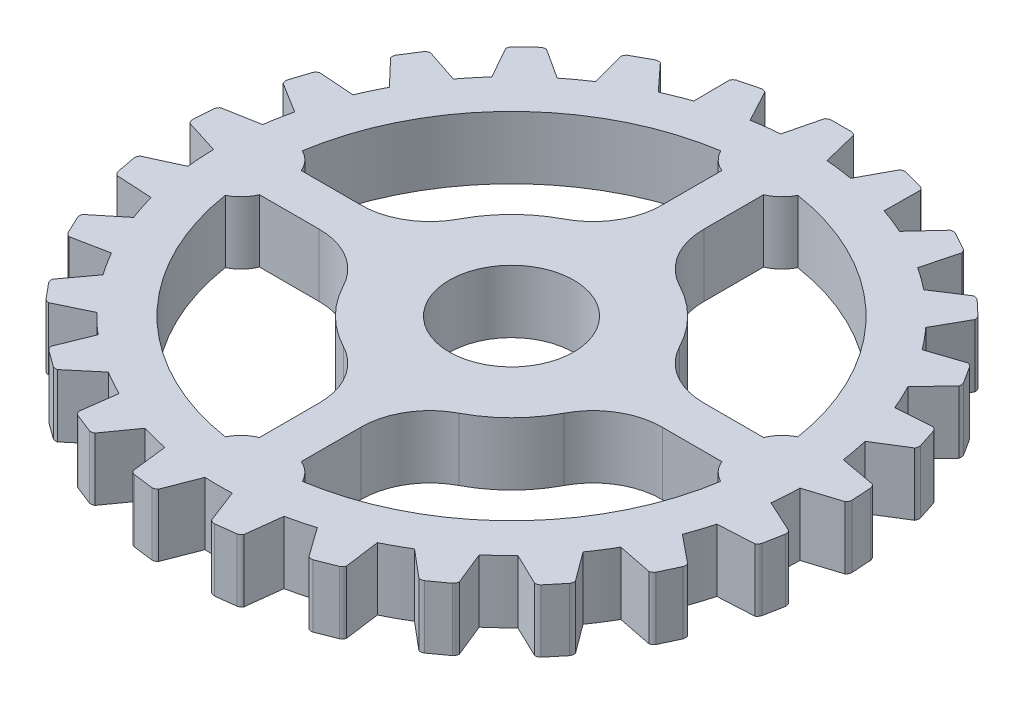
from build123d import *

# Parameters (mm, degrees)
SZKIC1_R                    = 29.81004902
DODANIE_WYCI_GNI_CIE2_DEPTH = 30


with BuildPart() as part:
    # Szkic1 → Dodanie-wyciągnięcie2 (new body)
    with BuildSketch(Plane(origin=(0, 0, 0), x_dir=(1, 0, 0), z_dir=(0, 1, 0))):
        with BuildLine():
            ThreePointArc((6.930347627, 127.950685559), (0.900324506, 130.502399747), (-5.242141735, 132.770115034))
            Line((-5.242141735, 132.770115034), (-5.099538392, 150.025168008))
            ThreePointArc((-5.099538392, 150.025168008), (-5.818909002, 150.99433569), (-6.838983407, 151.639493252))
            Line((-6.838983407, 151.639493252), (-16.212716976, 154.046258966))
            ThreePointArc((-16.212716976, 154.046258966), (-17.417422017, 153.972327677), (-18.514711379, 153.469598998))
            Line((-18.514711379, 153.469598998), (-26.702432285, 138.280181128))
            ThreePointArc((-26.702432285, 138.280181128), (-33.177596654, 139.252122754), (-39.691043882, 139.921024358))
            Line((-39.691043882, 139.921024358), (-43.844077863, 156.669442122))
            ThreePointArc((-43.844077863, 156.669442122), (-44.781870324, 157.429261423), (-45.930341376, 157.800467985))
            Line((-45.930341376, 157.800467985), (-55.608120162, 157.800467985))
            ThreePointArc((-55.608120162, 157.800467985), (-56.756591215, 157.429261423), (-57.694383676, 156.669442122))
            Line((-57.694383676, 156.669442122), (-61.847417657, 139.921024358))
            ThreePointArc((-61.847417657, 139.921024358), (-68.360864884, 139.252122754), (-74.836029254, 138.280181128))
            Line((-74.836029254, 138.280181128), (-83.023750159, 153.469598998))
            ThreePointArc((-83.023750159, 153.469598998), (-84.121039522, 153.972327677), (-85.325744562, 154.046258966))
            Line((-85.325744562, 154.046258966), (-94.699478132, 151.639493252))
            ThreePointArc((-94.699478132, 151.639493252), (-95.719552536, 150.99433569), (-96.438923146, 150.025168008))
            Line((-96.438923146, 150.025168008), (-96.296319804, 132.770115034))
            ThreePointArc((-96.296319804, 132.770115034), (-102.438786045, 130.502399747), (-108.468809166, 127.950685559))
            Line((-108.468809166, 127.950685559), (-120.176752379, 140.626696547))
            ThreePointArc((-120.176752379, 140.626696547), (-121.364591917, 140.840746312), (-122.549834897, 140.612756953))
            Line((-122.549834897, 140.612756953), (-131.030537095, 135.950451466))
            ThreePointArc((-131.030537095, 135.950451466), (-131.858119825, 135.071880527), (-132.313867883, 133.954260834))
            Line((-132.313867883, 133.954260834), (-127.88458751, 117.276771088))
            ThreePointArc((-127.88458751, 117.276771088), (-133.27011902, 113.552731011), (-138.476112363, 109.581577847))
            Line((-138.476112363, 109.581577847), (-152.968624752, 118.947701563))
            ThreePointArc((-152.968624752, 118.947701563), (-154.172378139, 118.859622881), (-155.263685884, 118.344038284))
            Line((-155.263685884, 118.344038284), (-162.318483002, 111.719142824))
            ThreePointArc((-162.318483002, 111.719142824), (-162.901573991, 110.66236235), (-163.06506317, 109.466514802))
            Line((-163.06506317, 109.466514802), (-154.627413742, 94.414496301))
            ThreePointArc((-154.627413742, 94.414496301), (-158.917617769, 89.468126567), (-162.972469626, 84.327056585))
            Line((-162.972469626, 84.327056585), (-179.338933339, 89.794785031))
            ThreePointArc((-179.338933339, 89.794785031), (-180.482964322, 89.410112208), (-181.411765952, 88.63932845))
            Line((-181.411765952, 88.63932845), (-186.597379141, 80.468109564))
            ThreePointArc((-186.597379141, 80.468109564), (-186.899340638, 79.29952096), (-186.760298312, 78.100585056))
            Line((-186.760298312, 78.100585056), (-174.844448374, 65.619811479))
            ThreePointArc((-174.844448374, 65.619811479), (-177.769755622, 59.761910691), (-180.418684737, 53.773956225))
            Line((-180.418684737, 53.773956225), (-197.630734667, 54.999731913))
            ThreePointArc((-197.630734667, 54.999731913), (-198.643159572, 54.342635359), (-199.351095065, 53.365083617))
            Line((-199.351095065, 53.365083617), (-202.341693178, 44.160969039))
            ThreePointArc((-202.341693178, 44.160969039), (-202.34355183, 42.953999024), (-201.910714541, 41.827308317))
            Line((-201.910714541, 41.827308317), (-187.265380767, 32.701992569))
            ThreePointArc((-187.265380767, 32.701992569), (-188.641983422, 26.300634177), (-189.718547838, 19.842040429))
            Line((-189.718547838, 19.842040429), (-206.694687586, 16.748843364))
            ThreePointArc((-206.694687586, 16.748843364), (-207.511892033, 15.860610871), (-207.954479198, 14.737714317))
            Line((-207.954479198, 14.737714317), (-208.562151956, 5.079032416))
            ThreePointArc((-208.562151956, 5.079032416), (-208.263790979, 3.909519356), (-207.564355484, 2.925867966))
            Line((-207.564355484, 2.925867966), (-191.109758058, -2.270612804))
            ThreePointArc((-191.109758058, -2.270612804), (-190.851159113, -8.81320791), (-190.287714328, -15.336623742))
            Line((-190.287714328, -15.336623742), (-205.9612706, -22.554436611))
            ThreePointArc((-205.9612706, -22.554436611), (-206.531906628, -23.617994128), (-206.681336086, -24.815679775))
            Line((-206.681336086, -24.815679775), (-204.867901175, -34.322038492))
            ThreePointArc((-204.867901175, -34.322038492), (-204.288067686, -35.380609791), (-203.365982089, -36.15941543))
            Line((-203.365982089, -36.15941543), (-186.136023883, -37.100547223))
            ThreePointArc((-186.136023883, -37.100547223), (-184.258472061, -43.373283731), (-182.090421382, -49.551631438))
            Line((-182.090421382, -49.551631438), (-195.476566995, -60.440538384))
            ThreePointArc((-195.476566995, -60.440538384), (-195.764779443, -61.612593696), (-195.611661992, -62.809813441))
            Line((-195.611661992, -62.809813441), (-191.491064196, -71.566529494))
            ThreePointArc((-191.491064196, -71.566529494), (-190.666191266, -72.447645104), (-189.579393598, -72.972669769))
            Line((-189.579393598, -72.972669769), (-172.656696253, -69.599317814))
            ThreePointArc((-172.656696253, -69.599317814), (-169.278165039, -75.208056619), (-165.641735065, -80.653127894))
            Line((-165.641735065, -80.653127894), (-175.899369258, -94.528938846))
            ThreePointArc((-175.899369258, -94.528938846), (-175.887048679, -95.735847407), (-175.441005251, -96.85737553))
            Line((-175.441005251, -96.85737553), (-169.272156885, -104.314232245))
            ThreePointArc((-169.272156885, -104.314232245), (-168.254074313, -104.962528432), (-167.070852067, -105.200782892))
            Line((-167.070852067, -105.200782892), (-151.518730895, -97.724907299))
            ThreePointArc((-151.518730895, -97.724907299), (-146.851505832, -102.317230714), (-141.975186831, -106.686891702))
            Line((-141.975186831, -106.686891702), (-148.459784724, -122.677738428))
            ThreePointArc((-148.459784724, -122.677738428), (-148.147705265, -123.843665733), (-147.436762409, -124.819032498))
            Line((-147.436762409, -124.819032498), (-139.607274903, -130.507488143))
            ThreePointArc((-139.607274903, -130.507488143), (-138.459952561, -130.882230073), (-137.254651943, -130.818743924))
            Line((-137.254651943, -130.818743924), (-124.050303914, -119.710081451))
            ThreePointArc((-124.050303914, -119.710081451), (-118.387643917, -122.997436907), (-112.577832946, -126.017125737))
            Line((-112.577832946, -126.017125737), (-114.881943404, -143.118244526))
            ThreePointArc((-114.881943404, -143.118244526), (-114.289714165, -144.169931076), (-113.358543035, -144.937850602))
            Line((-113.358543035, -144.937850602), (-104.360371884, -148.500478588))
            ThreePointArc((-104.360371884, -148.500478588), (-103.155900255, -148.578119848), (-102.004254736, -148.216882158))
            Line((-102.004254736, -148.216882158), (-91.977357598, -134.173430922))
            ThreePointArc((-91.977357598, -134.173430922), (-85.67506842, -135.949261786), (-79.296817271, -137.429240304))
            Line((-79.296817271, -137.429240304), (-77.275664559, -154.566104969))
            ThreePointArc((-77.275664559, -154.566104969), (-76.440497481, -155.43746943), (-75.347606985, -155.949690508))
            Line((-75.347606985, -155.949690508), (-65.746140375, -157.162637817))
            ThreePointArc((-65.746140375, -157.162637817), (-64.560200841, -156.93829992), (-63.534572544, -156.302008583))
            Line((-63.534572544, -156.302008583), (-57.315153121, -140.206170274))
            ThreePointArc((-57.315153121, -140.206170274), (-50.769230769, -140.35889456), (-44.223308418, -140.206170274))
            Line((-44.223308418, -140.206170274), (-38.003888995, -156.302008583))
            ThreePointArc((-38.003888995, -156.302008583), (-36.978260698, -156.93829992), (-35.792321164, -157.162637817))
            Line((-35.792321164, -157.162637817), (-26.190854554, -155.949690508))
            ThreePointArc((-26.190854554, -155.949690508), (-25.097964057, -155.43746943), (-24.26279698, -154.566104969))
            Line((-24.26279698, -154.566104969), (-22.241644268, -137.429240304))
            ThreePointArc((-22.241644268, -137.429240304), (-15.863393118, -135.949261786), (-9.56110394, -134.173430922))
            Line((-9.56110394, -134.173430922), (0.465793198, -148.216882158))
            ThreePointArc((0.465793198, -148.216882158), (1.617438717, -148.578119848), (2.821910346, -148.500478588))
            Line((2.821910346, -148.500478588), (11.820081497, -144.937850602))
            ThreePointArc((11.820081497, -144.937850602), (12.751252626, -144.169931076), (13.343481865, -143.118244526))
            Line((13.343481865, -143.118244526), (11.039371408, -126.017125737))
            ThreePointArc((11.039371408, -126.017125737), (16.849182378, -122.997436907), (22.511842376, -119.710081451))
            Line((22.511842376, -119.710081451), (35.716190405, -130.818743924))
            ThreePointArc((35.716190405, -130.818743924), (36.921491023, -130.882230073), (38.068813364, -130.507488143))
            Line((38.068813364, -130.507488143), (45.89830087, -124.819032498))
            ThreePointArc((45.89830087, -124.819032498), (46.609243726, -123.843665733), (46.921323185, -122.677738428))
            Line((46.921323185, -122.677738428), (40.436725293, -106.686891702))
            ThreePointArc((40.436725293, -106.686891702), (45.313044293, -102.317230714), (49.980269357, -97.724907299))
            Line((49.980269357, -97.724907299), (65.532390529, -105.200782892))
            ThreePointArc((65.532390529, -105.200782892), (66.715612774, -104.962528432), (67.733695347, -104.314232245))
            Line((67.733695347, -104.314232245), (73.902543713, -96.85737553))
            ThreePointArc((73.902543713, -96.85737553), (74.348587141, -95.735847407), (74.36090772, -94.528938846))
            Line((74.36090772, -94.528938846), (64.103273527, -80.653127894))
            ThreePointArc((64.103273527, -80.653127894), (67.739703501, -75.208056619), (71.118234714, -69.599317814))
            Line((71.118234714, -69.599317814), (88.040932059, -72.972669769))
            ThreePointArc((88.040932059, -72.972669769), (89.127729727, -72.447645104), (89.952602658, -71.566529494))
            Line((89.952602658, -71.566529494), (94.073200454, -62.809813441))
            ThreePointArc((94.073200454, -62.809813441), (94.226317905, -61.612593696), (93.938105456, -60.440538384))
            Line((93.938105456, -60.440538384), (80.551959844, -49.551631438))
            ThreePointArc((80.551959844, -49.551631438), (82.720010522, -43.373283731), (84.597562345, -37.100547223))
            Line((84.597562345, -37.100547223), (101.827520551, -36.15941543))
            ThreePointArc((101.827520551, -36.15941543), (102.749606147, -35.380609791), (103.329439636, -34.322038492))
            Line((103.329439636, -34.322038492), (105.142874547, -24.815679775))
            ThreePointArc((105.142874547, -24.815679775), (104.993445089, -23.617994129), (104.422809061, -22.554436611))
            Line((104.422809061, -22.554436611), (88.749252789, -15.336623742))
            ThreePointArc((88.749252789, -15.336623742), (89.312697575, -8.81320791), (89.57129652, -2.270612804))
            Line((89.57129652, -2.270612804), (106.025893945, 2.925867966))
            ThreePointArc((106.025893945, 2.925867966), (106.725329441, 3.909519356), (107.023690418, 5.079032416))
            Line((107.023690418, 5.079032416), (106.41601766, 14.737714317))
            ThreePointArc((106.41601766, 14.737714317), (105.973430495, 15.860610871), (105.156226048, 16.748843364))
            Line((105.156226048, 16.748843364), (88.180086299, 19.842040429))
            ThreePointArc((88.180086299, 19.842040429), (87.103521884, 26.300634177), (85.726919229, 32.701992569))
            Line((85.726919229, 32.701992569), (100.372253002, 41.827308317))
            ThreePointArc((100.372253002, 41.827308317), (100.805090292, 42.953999024), (100.803231639, 44.160969039))
            Line((100.803231639, 44.160969039), (97.812633526, 53.365083617))
            ThreePointArc((97.812633526, 53.365083617), (97.104698034, 54.342635359), (96.092273129, 54.999731913))
            Line((96.092273129, 54.999731913), (78.880223198, 53.773956225))
            ThreePointArc((78.880223198, 53.773956225), (76.231294083, 59.761910691), (73.305986835, 65.619811479))
            Line((73.305986835, 65.619811479), (85.221836774, 78.100585056))
            ThreePointArc((85.221836774, 78.100585056), (85.360879099, 79.29952096), (85.058917603, 80.468109564))
            Line((85.058917603, 80.468109564), (79.873304413, 88.63932845))
            ThreePointArc((79.873304413, 88.63932845), (78.944502783, 89.410112208), (77.800471801, 89.794785031))
            Line((77.800471801, 89.794785031), (61.434008087, 84.327056585))
            ThreePointArc((61.434008087, 84.327056585), (57.379156231, 89.468126567), (53.088952203, 94.414496301))
            Line((53.088952203, 94.414496301), (61.526601632, 109.466514802))
            ThreePointArc((61.526601632, 109.466514802), (61.363112452, 110.66236235), (60.780021464, 111.719142824))
            Line((60.780021464, 111.719142824), (53.725224345, 118.344038284))
            ThreePointArc((53.725224345, 118.344038284), (52.633916601, 118.859622881), (51.430163214, 118.947701563))
            Line((51.430163214, 118.947701563), (36.937650824, 109.581577847))
            ThreePointArc((36.937650824, 109.581577847), (31.731657481, 113.552731011), (26.346125972, 117.276771088))
            Line((26.346125972, 117.276771088), (30.775406345, 133.954260834))
            ThreePointArc((30.775406345, 133.954260834), (30.319658287, 135.071880527), (29.492075557, 135.950451466))
            Line((29.492075557, 135.950451466), (21.011373358, 140.612756953))
            ThreePointArc((21.011373358, 140.612756953), (19.826130378, 140.840746312), (18.63829084, 140.626696547))
            Line((18.63829084, 140.626696547), (6.930347627, 127.950685559))
        make_face()
        with BuildLine():
            ThreePointArc((-78.358487519, -52.852521247), (-65.560650176, -64.859964575), (-60.769230769, -81.742074514))
            ThreePointArc((-60.769230769, -81.742074514), (-60.768601245, -81.945457497), (-60.769230769, -82.14884048))
            Line((-60.769230769, -82.14884048), (-60.769230769, -110.656311011))
            ThreePointArc((-60.769230769, -110.656311011), (-65.702218266, -113.856728555), (-69.212541036, -118.57421434))
            ThreePointArc((-69.212541036, -118.57421434), (-135.622044512, -84.852813742), (-169.343445109, -18.443310267))
            ThreePointArc((-169.343445109, -18.443310267), (-164.625959324, -14.932987496), (-161.425541781, -10))
            Line((-161.425541781, -10), (-132.918071249, -10))
            ThreePointArc((-132.918071249, -10), (-132.714688266, -9.999370476), (-132.511305284, -10))
            ThreePointArc((-132.511305284, -10), (-115.629195344, -14.791419406), (-103.621752017, -27.58925675))
            ThreePointArc((-103.621752017, -27.58925675), (-103.601156252, -27.628575689), (-103.580613626, -27.667922419))
            ThreePointArc((-103.580613626, -27.667922419), (-92.927006388, -42.157775619), (-78.437153188, -52.811382857))
            ThreePointArc((-78.437153188, -52.811382857), (-78.397806459, -52.831925482), (-78.358487519, -52.852521247))
        make_face(mode=Mode.SUBTRACT)
        with Locations(Location((-50.769230769, 0, 0), (0, 0, 270))):
            Circle(SZKIC1_R, mode=Mode.SUBTRACT)
        with BuildLine():
            ThreePointArc((-40.769230769, -82.14884048), (-40.769860294, -81.945457497), (-40.769230769, -81.742074514))
            ThreePointArc((-40.769230769, -81.742074514), (-35.977811363, -64.859964575), (-23.17997402, -52.852521247))
            ThreePointArc((-23.17997402, -52.852521247), (-23.14065508, -52.831925482), (-23.101308351, -52.811382857))
            ThreePointArc((-23.101308351, -52.811382857), (-8.611455151, -42.157775619), (2.042152088, -27.667922419))
            ThreePointArc((2.042152088, -27.667922419), (2.062735924, -27.628597241), (2.083290478, -27.58925675))
            ThreePointArc((2.083290478, -27.58925675), (14.090733806, -14.791419406), (30.972843745, -10))
            ThreePointArc((30.972843745, -10), (31.176226728, -9.999370476), (31.379609711, -10))
            Line((31.379609711, -10), (59.887080242, -10))
            ThreePointArc((59.887080242, -10), (63.087497785, -14.932987496), (67.804983571, -18.443310267))
            ThreePointArc((67.804983571, -18.443310267), (34.083582973, -84.852813742), (-32.325920503, -118.57421434))
            ThreePointArc((-32.325920503, -118.57421434), (-35.836243273, -113.856728555), (-40.769230769, -110.656311011))
            Line((-40.769230769, -110.656311011), (-40.769230769, -82.14884048))
        make_face(mode=Mode.SUBTRACT)
        with BuildLine():
            ThreePointArc((-60.769230769, 82.14884048), (-60.768601245, 81.945457497), (-60.769230769, 81.742074514))
            ThreePointArc((-60.769230769, 81.742074514), (-65.560650176, 64.859964575), (-78.358487519, 52.852521247))
            ThreePointArc((-78.358487519, 52.852521247), (-78.39782801, 52.831966694), (-78.437153188, 52.811382857))
            ThreePointArc((-78.437153188, 52.811382857), (-92.927006388, 42.157775619), (-103.580613626, 27.667922419))
            ThreePointArc((-103.580613626, 27.667922419), (-103.601197463, 27.628597241), (-103.621752017, 27.58925675))
            ThreePointArc((-103.621752017, 27.58925675), (-115.629195344, 14.791419406), (-132.511305284, 10))
            ThreePointArc((-132.511305284, 10), (-132.714688266, 9.999370476), (-132.918071249, 10))
            Line((-132.918071249, 10), (-161.425541781, 10))
            ThreePointArc((-161.425541781, 10), (-164.625959324, 14.932987496), (-169.343445109, 18.443310267))
            ThreePointArc((-169.343445109, 18.443310267), (-135.622044512, 84.852813742), (-69.212541036, 118.57421434))
            ThreePointArc((-69.212541036, 118.57421434), (-65.702218266, 113.856728555), (-60.769230769, 110.656311011))
            Line((-60.769230769, 110.656311011), (-60.769230769, 82.14884048))
        make_face(mode=Mode.SUBTRACT)
        with BuildLine():
            ThreePointArc((31.379609711, 10), (31.176226728, 9.999370476), (30.972843745, 10))
            ThreePointArc((30.972843745, 10), (14.090733806, 14.791419406), (2.083290478, 27.58925675))
            ThreePointArc((2.083290478, 27.58925675), (2.062694713, 27.628575689), (2.042152088, 27.667922419))
            ThreePointArc((2.042152088, 27.667922419), (-8.611455151, 42.157775619), (-23.101308351, 52.811382857))
            ThreePointArc((-23.101308351, 52.811382857), (-23.14065508, 52.831925482), (-23.17997402, 52.852521247))
            ThreePointArc((-23.17997402, 52.852521247), (-35.977811363, 64.859964575), (-40.769230769, 81.742074514))
            ThreePointArc((-40.769230769, 81.742074514), (-40.769860294, 81.945457497), (-40.769230769, 82.14884048))
            Line((-40.769230769, 82.14884048), (-40.769230769, 110.656311011))
            ThreePointArc((-40.769230769, 110.656311011), (-35.836243273, 113.856728555), (-32.325920503, 118.57421434))
            ThreePointArc((-32.325920503, 118.57421434), (34.083582973, 84.852813742), (67.804983571, 18.443310267))
            ThreePointArc((67.804983571, 18.443310267), (63.087497785, 14.932987496), (59.887080242, 10))
            Line((59.887080242, 10), (31.379609711, 10))
        make_face(mode=Mode.SUBTRACT)
    extrude(amount=DODANIE_WYCI_GNI_CIE2_DEPTH)


solid = part.part
